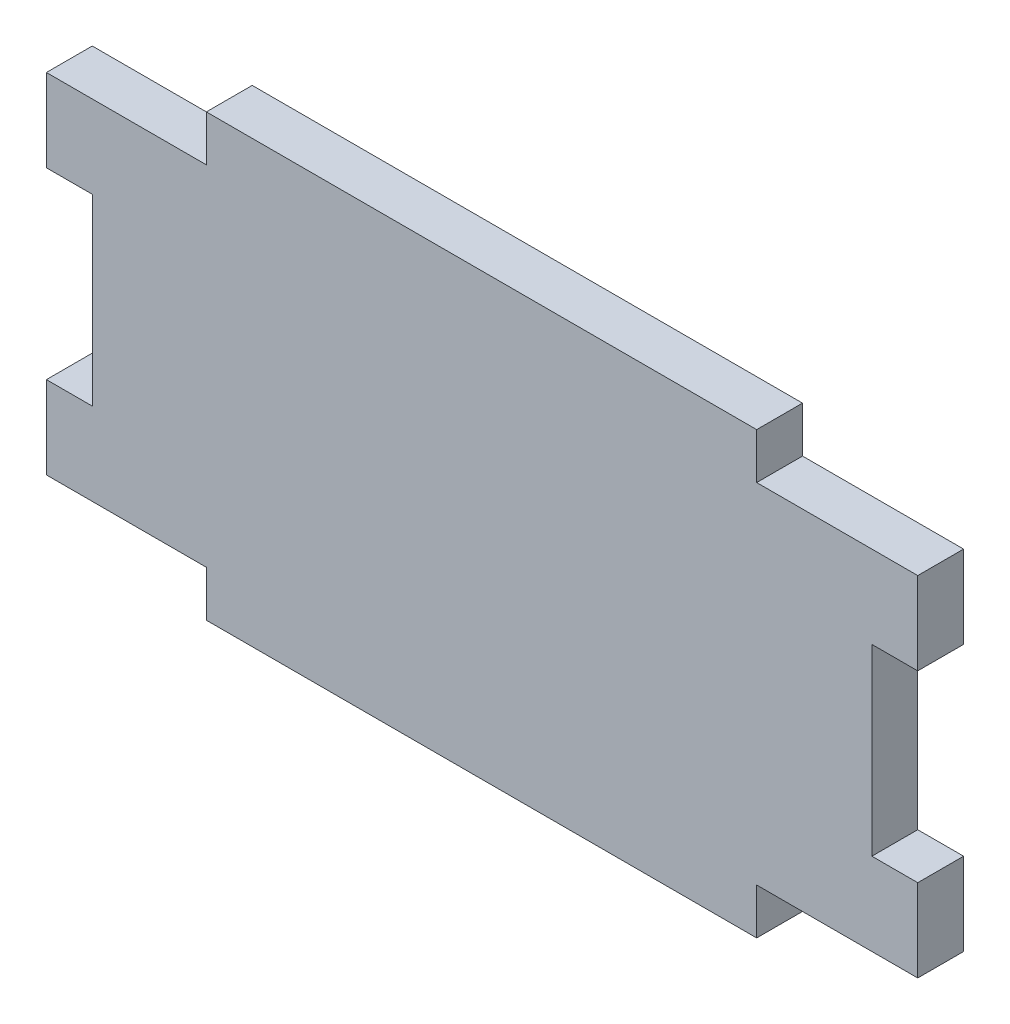
from build123d import *

# Parameters (mm, degrees)
AUFSATZ_LINEAR_AUSTRAGEN1_DEPTH = 5


with BuildPart() as part:
    # Skizze1 → Aufsatz-Linear austragen1 (new body)
    with BuildSketch(Plane.XY):
        Polygon((-79.835742472, -70.268113146), (-139.835742472, -70.268113146), (-139.835742472, -75.268113146), (-157.274617185, -75.268113146), (-157.274617185, -84.268113146), (-152.274617185, -84.268113146), (-152.274617185, -104.268113146), (-157.274617185, -104.268113146), (-157.274617185, -113.268113146), (-139.835742472, -113.268113146), (-139.835742472, -118.268113146), (-79.835742472, -118.268113146), (-79.835742472, -113.268113146), (-62.274617185, -113.268113146), (-62.274617185, -104.268113146), (-67.274617185, -104.268113146), (-67.274617185, -84.268113146), (-62.274617185, -84.268113146), (-62.274617185, -75.268113146), (-79.835742472, -75.268113146), align=None)
    extrude(amount=AUFSATZ_LINEAR_AUSTRAGEN1_DEPTH)


solid = part.part
